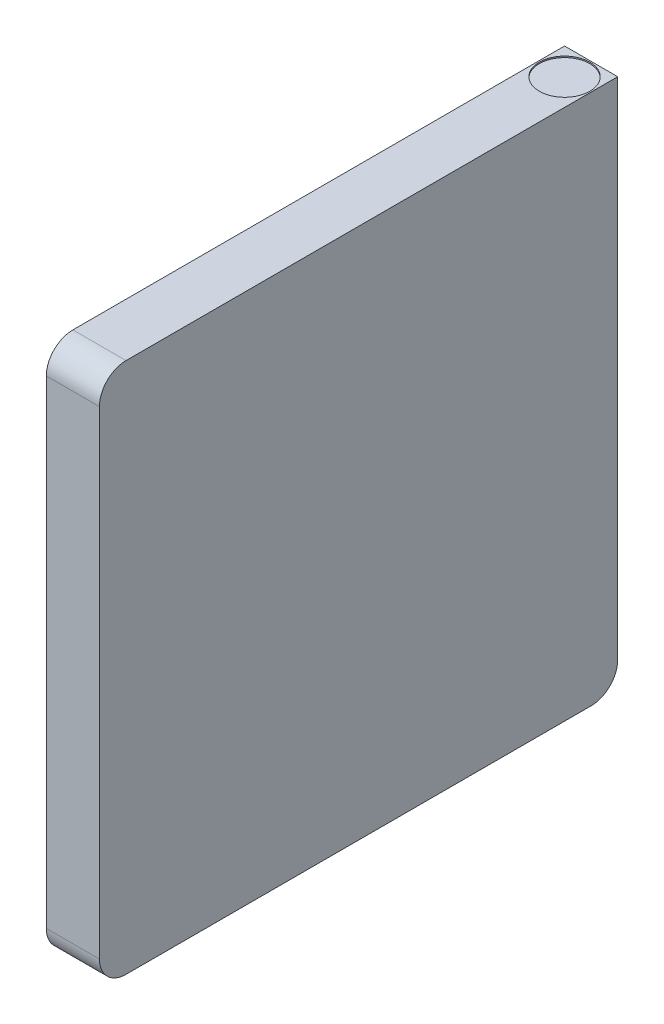
from build123d import *

# Parameters (mm, degrees)
SKETCH1_W           = 4
SKETCH1_H           = 40
BOSS_EXTRUDE1_DEPTH = 39
FILLET6_R           = 2
FILLET7_R           = 2
SKETCH7_R           = 1.9
CUT_EXTRUDE4_DEPTH  = 0.1


with BuildPart() as part:
    # Sketch1 → Boss-Extrude1 (new body)
    with BuildSketch(Plane.XY):
        with Locations((-2, 5.490763705)):
            Rectangle(SKETCH1_W, SKETCH1_H)
    extrude(amount=BOSS_EXTRUDE1_DEPTH)

    # Fillet6
    fillet6_edges = [part.edges().sort_by_distance(p)[0] for p in [
        (-2, 25.490763705, 39),
    ]]
    fillet(fillet6_edges, radius=FILLET6_R)

    # Fillet7
    fillet7_edges = [part.edges().sort_by_distance(p)[0] for p in [
        (-2, -14.509236295, 0),
        (-2, -14.509236295, 39),
    ]]
    fillet(fillet7_edges, radius=FILLET7_R)

    # Sketch7 → Cut-Extrude4 (cut)
    with BuildSketch(Plane(origin=(0, 25.490763705, 0), x_dir=(1, 0, 0), z_dir=(0, 1, 0))):
        with Locations(Location((-2, -2, 0), (0, 0, 270))):
            Circle(SKETCH7_R)
    extrude(amount=-CUT_EXTRUDE4_DEPTH, mode=Mode.SUBTRACT)


solid = part.part
